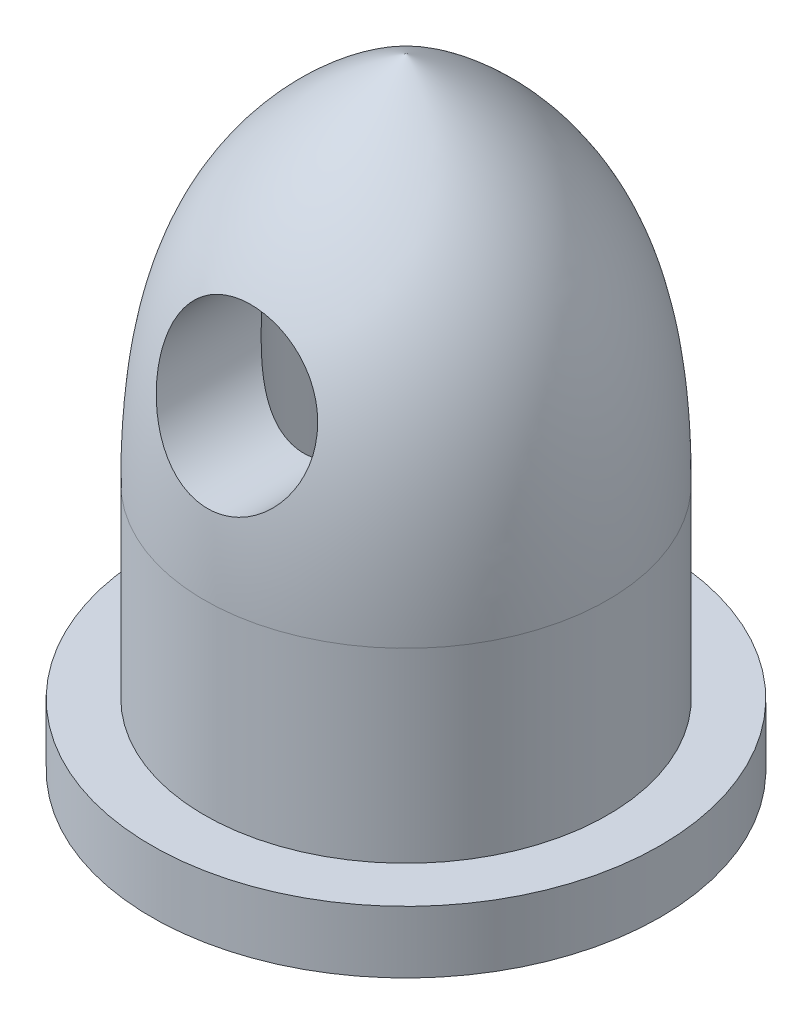
from build123d import *

# Parameters (mm, degrees)
M4X0_7_TAPPED_HOLE1_D     = 3.3
M4X0_7_TAPPED_HOLE1_DEPTH = 8.5
M4X0_7_TAPPED_HOLE1_TIP   = 0.991420021
CUT_EXTRUDE1_DEPTH        = 12.559411836
CUT_EXTRUDE1_DEPTH_BACK   = 12.559411836
SKETCH4_R                 = 1.25


with BuildPart() as part:
    # Sketch1 → Revolve1 (revolve)
    with BuildSketch(Plane.XY):
        with BuildLine():
            Line((0, 0), (-4.1, 0))
            Line((-4.1, 0), (-4.1, 1))
            Line((-4.1, 1), (-3.25, 1))
            Line((-3.25, 1), (-3.25, 4))
            add(Edge.make_bspline(
                [(-3.25, 4), (-3.25, 6.809673905), (-2.594523583, 8.691122547), (0, 10)],
                knots=[0, 0, 0, 0, 1, 1, 1, 1], degree=3))
            Line((0, 10), (0, 0))
        make_face()
    revolve(axis=Axis((0, 10, 0), (0, -1, 0)))

    # M4x0.7 Tapped Hole1
    with Locations(Plane(origin=(0, 0, 0), x_dir=(-1, 0, 0), z_dir=(0, -1, 0))):
        with Locations((0, 0)):
            Hole(M4X0_7_TAPPED_HOLE1_D / 2, depth=M4X0_7_TAPPED_HOLE1_DEPTH)
            with Locations((0, 0, -(M4X0_7_TAPPED_HOLE1_DEPTH + M4X0_7_TAPPED_HOLE1_TIP / 2))):  # 118° drill point
                Cone(0, M4X0_7_TAPPED_HOLE1_D / 2, M4X0_7_TAPPED_HOLE1_TIP, mode=Mode.SUBTRACT)

    # Sketch4 → Cut-Extrude1 (cut, two sides: drawn at the far end of the back side and taken through both)
    with BuildSketch(Plane.XY.offset(-CUT_EXTRUDE1_DEPTH_BACK)):
        with Locations((0, 6.5)):
            Circle(SKETCH4_R)
    extrude(amount=CUT_EXTRUDE1_DEPTH + CUT_EXTRUDE1_DEPTH_BACK, mode=Mode.SUBTRACT)


solid = part.part
